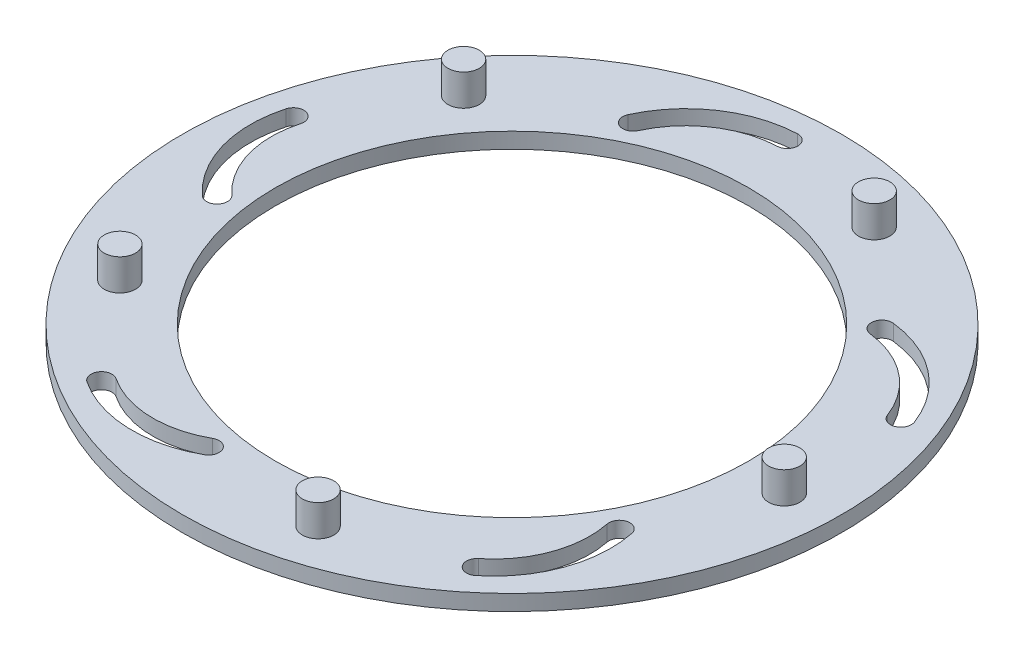
from build123d import *

# Parameters (mm, degrees)
SKETCH1_R           = 31.5
SKETCH1_R_2         = 22.625
BOSS_EXTRUDE1_DEPTH = 1.5
SKETCH2_R           = 1.5
BOSS_EXTRUDE2_DEPTH = 3


with BuildPart() as part:
    # Sketch1 → Boss-Extrude1 (new body)
    with BuildSketch(Plane(origin=(0, 0, 0), x_dir=(1, 0, 0), z_dir=(0, 1, 0))):
        with Locations(Location((0, 0, 0), (0, 0, 270))):
            Circle(SKETCH1_R)
        with Locations(Location((0, 0, 0), (0, 0, 270))):
            Circle(SKETCH1_R_2, mode=Mode.SUBTRACT)
        with BuildLine():
            ThreePointArc((-11.821381939, 22.907790728), (-7.904609513, 27.531658188), (-2.147738601, 29.423666069))
            ThreePointArc((-2.147738601, 29.423666069), (-1.106349013, 28.466844389), (-2.063170693, 27.425454801))
            ThreePointArc((-2.063170693, 27.425454801), (-6.78729401, 25.872861616), (-10.001421306, 22.07848783))
            ThreePointArc((-10.001421306, 22.07848783), (-11.326053072, 21.583158963), (-11.821381939, 22.907790728))
        make_face(mode=Mode.SUBTRACT)
        with BuildLine():
            ThreePointArc((17.907280569, 16.334544855), (22.509164441, 14.450254128), (25.445602695, 10.437123544))
            ThreePointArc((25.445602695, 10.437123544), (26.731697208, 9.848939131), (27.319881621, 11.135033644))
            ThreePointArc((27.319881621, 11.135033644), (23.741504251, 16.02548065), (18.13359573, 18.321698963))
            ThreePointArc((18.13359573, 18.321698963), (17.026861096, 17.44127949), (17.907280569, 16.334544855))
        make_face(mode=Mode.SUBTRACT)
        with BuildLine():
            ThreePointArc((21.068729344, -11.983183919), (20.698722692, -16.942113419), (17.789418023, -20.974957706))
            ThreePointArc((17.789418023, -20.974957706), (17.627446465, -22.379865253), (19.032354011, -22.541836811))
            ThreePointArc((19.032354011, -22.541836811), (22.577666084, -17.62736646), (23.028560438, -11.584358037))
            ThreePointArc((23.028560438, -11.584358037), (21.849231951, -10.803855431), (21.068729344, -11.983183919))
        make_face(mode=Mode.SUBTRACT)
        with BuildLine():
            ThreePointArc((-4.886089735, -23.74055981), (-9.716650293, -24.921056063), (-14.451137717, -23.400360319))
            ThreePointArc((-14.451137717, -23.400360319), (-15.837336158, -23.680456521), (-15.557239956, -25.066654962))
            ThreePointArc((-15.557239956, -25.066654962), (-9.787739224, -26.919792254), (-3.901162667, -25.481225968))
            ThreePointArc((-3.901162667, -25.481225968), (-3.523293122, -24.118429356), (-4.886089735, -23.74055981))
        make_face(mode=Mode.SUBTRACT)
        with BuildLine():
            ThreePointArc((-24.088498872, -2.689288956), (-26.70394283, 1.540053737), (-26.720712308, 6.51273968))
            ThreePointArc((-26.720712308, 6.51273968), (-27.415458501, 7.744538254), (-28.647257075, 7.04979206))
            ThreePointArc((-28.647257075, 7.04979206), (-28.626821597, 0.990019877), (-25.439611562, -4.163905686))
            ThreePointArc((-25.439611562, -4.163905686), (-24.026746852, -4.102153666), (-24.088498872, -2.689288956))
        make_face(mode=Mode.SUBTRACT)
    extrude(amount=BOSS_EXTRUDE1_DEPTH)

    # Sketch2 → Boss-Extrude2 (add)
    with BuildSketch(Plane(origin=(0, 1.5, 0), x_dir=(1, 0, 0), z_dir=(0, 1, 0))):
        with Locations(Location((-21.264622422, 16.637783303, 0), (0, 0, 270))):
            Circle(SKETCH2_R)
        with Locations(Location((9.252342519, 25.365215511, 0), (0, 0, 270))):
            Circle(SKETCH2_R)
        with Locations(Location((26.982884575, -0.961217985, 0), (0, 0, 270))):
            Circle(SKETCH2_R)
        with Locations(Location((7.423997262, -25.959280896, 0), (0, 0, 270))):
            Circle(SKETCH2_R)
        with Locations(Location((-22.394601934, -15.082499932, 0), (0, 0, 270))):
            Circle(SKETCH2_R)
    extrude(amount=BOSS_EXTRUDE2_DEPTH)


solid = part.part
